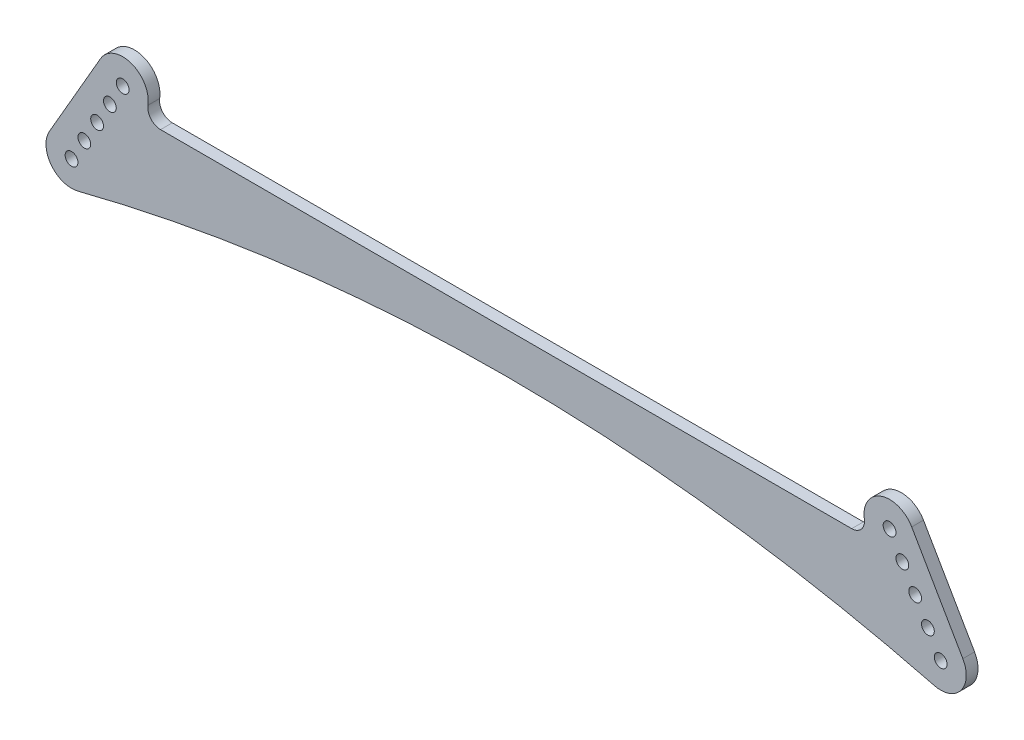
from build123d import *

# Parameters (mm, degrees)
SKETCH1_R           = 3.175
BOSS_EXTRUDE1_DEPTH = 5.842
FILLET1_R           = 6.35


with BuildPart() as part:
    # Sketch1 → Boss-Extrude1 (new body)
    with BuildSketch(Plane.XY):
        with BuildLine():
            Line((-226.924230888, -367.644297366), (-214.224230888, -345.64725211))
            Line((-214.224230888, -345.64725211), (-201.524230888, -323.650206854))
            ThreePointArc((-201.524230888, -323.650206854), (-182.614690973, -320.065127313), (-181.873832769, -339.29725211))
            Line((-181.873832769, -339.29725211), (181.873832769, -339.29725211))
            ThreePointArc((181.873832769, -339.29725211), (182.614690973, -320.065127313), (201.524230888, -323.650206854))
            Line((201.524230888, -323.650206854), (214.224230888, -345.64725211))
            Line((214.224230888, -345.64725211), (226.924230888, -367.644297366))
            ThreePointArc((226.924230888, -367.644297366), (226.046266682, -381.666604531), (212.782184711, -386.299103732))
            ThreePointArc((212.782184711, -386.299103732), (0, -359.548814266), (-212.782184711, -386.299103732))
            ThreePointArc((-212.782184711, -386.299103732), (-226.046266682, -381.666604531), (-226.924230888, -367.644297366))
        make_face()
        with Locations((-203.22570826, -351.99725211)):
            Circle(SKETCH1_R, mode=Mode.SUBTRACT)
        with Locations((-209.57570826, -362.995774738)):
            Circle(SKETCH1_R, mode=Mode.SUBTRACT)
        with Locations((-215.92570826, -373.994297366)):
            Circle(SKETCH1_R, mode=Mode.SUBTRACT)
        with Locations(Location((196.87570826, -340.998729482, 0), (0, 0, 180))):
            Circle(SKETCH1_R, mode=Mode.SUBTRACT)
        with Locations(Location((203.22570826, -351.99725211, 0), (0, 0, 180))):
            Circle(SKETCH1_R, mode=Mode.SUBTRACT)
        with Locations(Location((209.57570826, -362.995774738, 0), (0, 0, 180))):
            Circle(SKETCH1_R, mode=Mode.SUBTRACT)
        with Locations(Location((215.92570826, -373.994297366, 0), (0, 0, 180))):
            Circle(SKETCH1_R, mode=Mode.SUBTRACT)
        with Locations((-196.87570826, -340.998729482)):
            Circle(SKETCH1_R, mode=Mode.SUBTRACT)
        with Locations((-190.52570826, -330.000206854)):
            Circle(SKETCH1_R, mode=Mode.SUBTRACT)
        with Locations(Location((190.52570826, -330.000206854, 0), (0, 0, 180))):
            Circle(SKETCH1_R, mode=Mode.SUBTRACT)
    extrude(amount=BOSS_EXTRUDE1_DEPTH)

    # Fillet1
    fillet1_edges = [part.edges().sort_by_distance(p)[0] for p in [
        (-181.873832769, -339.29725211, 2.921),
        (181.873832769, -339.29725211, 2.921),
    ]]
    fillet(fillet1_edges, radius=FILLET1_R)


solid = part.part
